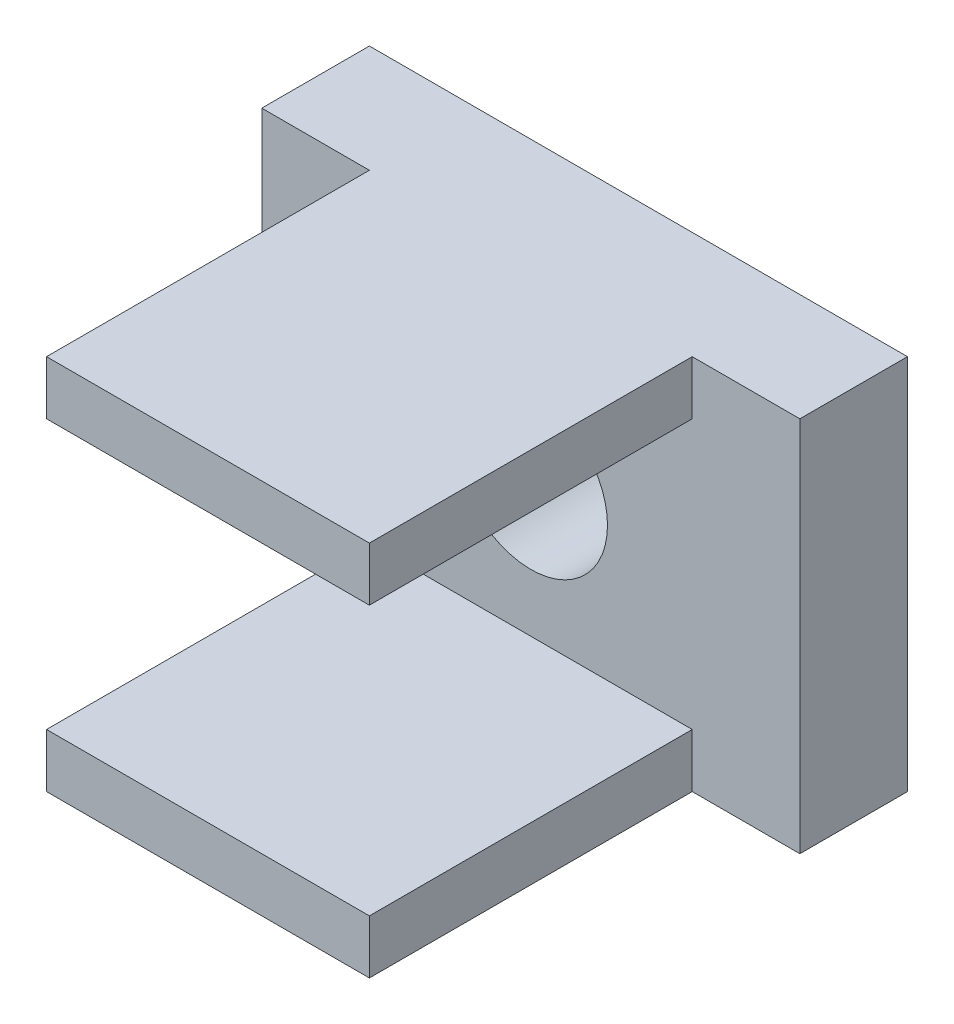
from build123d import *

# Parameters (mm, degrees)
SKETCH1_W           = 10
SKETCH1_H           = 7
BOSS_EXTRUDE1_DEPTH = 2
SKETCH2_R           = 1.425
CUT_EXTRUDE1_DEPTH  = 7.422616289
SKETCH3_W           = 6
SKETCH3_H           = 1
BOSS_EXTRUDE2_DEPTH = 6


with BuildPart() as part:
    # Sketch1 → Boss-Extrude1 (new body)
    with BuildSketch(Plane.XY):
        Rectangle(SKETCH1_W, SKETCH1_H)
    extrude(amount=BOSS_EXTRUDE1_DEPTH)

    # Sketch2 → Cut-Extrude1 (cut, through all)
    with BuildSketch(Plane.XY.offset(2)):
        Circle(SKETCH2_R)
    extrude(amount=-CUT_EXTRUDE1_DEPTH, mode=Mode.SUBTRACT)

    # Sketch3 → Boss-Extrude2 (add)
    with BuildSketch(Plane.XY.offset(2)):
        with Locations((0, 3)):
            Rectangle(SKETCH3_W, SKETCH3_H)
    boss_extrude2 = extrude(amount=BOSS_EXTRUDE2_DEPTH)

    # Mirror1: Boss-Extrude2 across plane
    add(boss_extrude2.mirror(Plane.ZX))


solid = part.part
